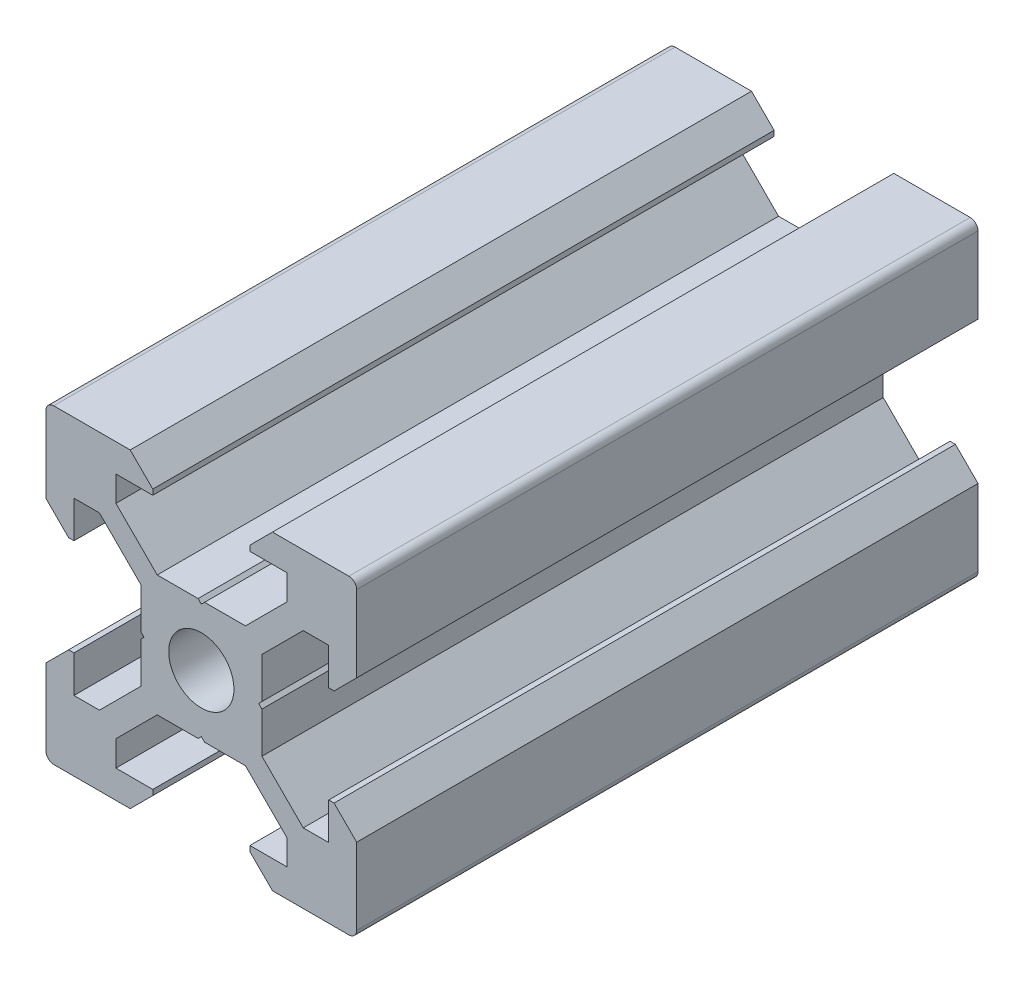
from build123d import *

# Parameters (mm, degrees)
SKETCH1_R           = 2.1
BOSS_EXTRUDE1_DEPTH = 40


with BuildPart() as part:
    # Sketch1 → Boss-Extrude1 (new body)
    with BuildSketch(Plane(origin=(0, 0, 0), x_dir=(-1, 0, 0), z_dir=(0, 0, -1))):
        with BuildLine():
            Line((-3.9, -0.21), (-3.9, -2.839339828))
            Line((-3.9, -2.839339828), (-6.560660172, -5.5))
            Line((-6.560660172, -5.5), (-8.2, -5.5))
            Line((-8.2, -5.5), (-8.2, -3.125))
            Line((-8.2, -3.125), (-8.545, -3.125))
            Line((-8.545, -3.125), (-10, -4.58))
            Line((-10, -4.58), (-10, -9.5))
            ThreePointArc((-10, -9.5), (-9.853553391, -9.853553391), (-9.5, -10))
            Line((-9.5, -10), (-4.58, -10))
            Line((-4.58, -10), (-3.125, -8.545))
            Line((-3.125, -8.545), (-3.125, -8.2))
            Line((-3.125, -8.2), (-5.5, -8.2))
            Line((-5.5, -8.2), (-5.5, -6.560660172))
            Line((-5.5, -6.560660172), (-2.839339828, -3.9))
            Line((-2.839339828, -3.9), (-0.21, -3.9))
            Line((-0.21, -3.9), (0, -3.69))
            Line((0, -3.69), (0.21, -3.9))
            Line((0.21, -3.9), (2.839339828, -3.9))
            Line((2.839339828, -3.9), (5.5, -6.560660172))
            Line((5.5, -6.560660172), (5.5, -8.2))
            Line((5.5, -8.2), (3.125, -8.2))
            Line((3.125, -8.2), (3.125, -8.545))
            Line((3.125, -8.545), (4.58, -10))
            Line((4.58, -10), (9.5, -10))
            ThreePointArc((9.5, -10), (9.853553391, -9.853553391), (10, -9.5))
            Line((10, -9.5), (10, -4.58))
            Line((10, -4.58), (8.545, -3.125))
            Line((8.545, -3.125), (8.2, -3.125))
            Line((8.2, -3.125), (8.2, -5.5))
            Line((8.2, -5.5), (6.560660172, -5.5))
            Line((6.560660172, -5.5), (3.9, -2.839339828))
            Line((3.9, -2.839339828), (3.9, -0.21))
            Line((3.9, -0.21), (3.69, 0))
            Line((3.69, 0), (3.9, 0.21))
            Line((3.9, 0.21), (3.9, 2.839339828))
            Line((3.9, 2.839339828), (6.560660172, 5.5))
            Line((6.560660172, 5.5), (8.2, 5.5))
            Line((8.2, 5.5), (8.2, 3.125))
            Line((8.2, 3.125), (8.545, 3.125))
            Line((8.545, 3.125), (10, 4.58))
            Line((10, 4.58), (10, 9.5))
            ThreePointArc((10, 9.5), (9.853553391, 9.853553391), (9.5, 10))
            Line((9.5, 10), (4.58, 10))
            Line((4.58, 10), (3.125, 8.545))
            Line((3.125, 8.545), (3.125, 8.2))
            Line((3.125, 8.2), (5.5, 8.2))
            Line((5.5, 8.2), (5.5, 6.560660172))
            Line((5.5, 6.560660172), (2.839339828, 3.9))
            Line((2.839339828, 3.9), (0.21, 3.9))
            Line((0.21, 3.9), (0, 3.69))
            Line((0, 3.69), (-0.21, 3.9))
            Line((-0.21, 3.9), (-2.839339828, 3.9))
            Line((-2.839339828, 3.9), (-5.5, 6.560660172))
            Line((-5.5, 6.560660172), (-5.5, 8.2))
            Line((-5.5, 8.2), (-3.125, 8.2))
            Line((-3.125, 8.2), (-3.125, 8.545))
            Line((-3.125, 8.545), (-4.58, 10))
            Line((-4.58, 10), (-9.5, 10))
            ThreePointArc((-9.5, 10), (-9.853553391, 9.853553391), (-10, 9.5))
            Line((-10, 9.5), (-10, 4.58))
            Line((-10, 4.58), (-8.545, 3.125))
            Line((-8.545, 3.125), (-8.2, 3.125))
            Line((-8.2, 3.125), (-8.2, 5.5))
            Line((-8.2, 5.5), (-6.560660172, 5.5))
            Line((-6.560660172, 5.5), (-3.9, 2.839339828))
            Line((-3.9, 2.839339828), (-3.9, 0.21))
            Line((-3.9, 0.21), (-3.69, 0))
            Line((-3.69, 0), (-3.9, -0.21))
        make_face()
        with Locations(Location((0, 0, 0), (0, 0, 180))):
            Circle(SKETCH1_R, mode=Mode.SUBTRACT)
    extrude(amount=-BOSS_EXTRUDE1_DEPTH)


solid = part.part
